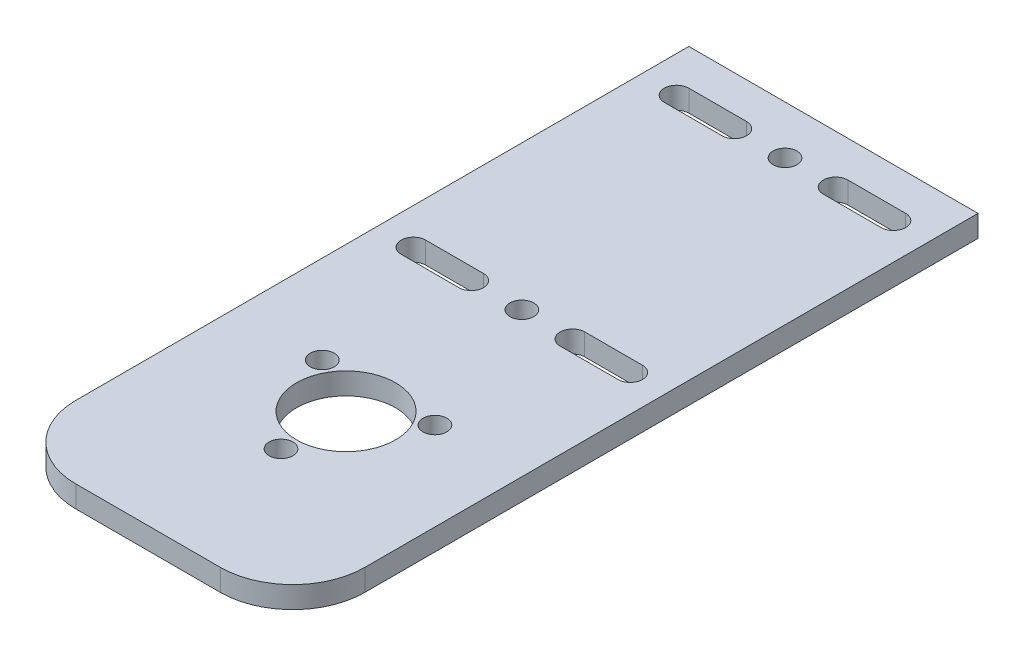
from build123d import *

# Parameters (mm, degrees)
SKETCH_1_R          = 1.65
SKETCH_1_R_2        = 6.85
EXTRUDE_1_DEPTH     = 3
FILLET_1_R          = 10
SKETCH_2_W          = 40
SKETCH_2_H          = 72.562953015
CUT_EXTRUDE_1_DEPTH = 10


with BuildPart() as part:
    # 草图1 → 凸台-拉伸1 (new body)
    with BuildSketch(Plane(origin=(0, 0, 0), x_dir=(1, 0, 0), z_dir=(0, 1, 0))):
        Polygon((0, 0), (0, 50.01), (40, 50.01), (40, 0), (40, -89.81), (0, -89.81), align=None)
        with Locations(Location((20, -1.7, 0), (0, 0, 270))):
            Circle(SKETCH_1_R, mode=Mode.SUBTRACT)
        with Locations(Location((20, -38.1, 0), (0, 0, 270))):
            Circle(SKETCH_1_R, mode=Mode.SUBTRACT)
        with Locations(Location((20, 31.62, 0), (0, 0, 270))):
            Circle(SKETCH_1_R, mode=Mode.SUBTRACT)
        with Locations(Location((27.794228634, 18.12, 0), (0, 0, 270))):
            Circle(SKETCH_1_R, mode=Mode.SUBTRACT)
        with Locations(Location((12.205771366, 18.12, 0), (0, 0, 270))):
            Circle(SKETCH_1_R, mode=Mode.SUBTRACT)
        with Locations(Location((27.794228634, -57.92, 0), (0, 0, 270))):
            Circle(SKETCH_1_R, mode=Mode.SUBTRACT)
        with Locations(Location((12.205771366, -57.92, 0), (0, 0, 270))):
            Circle(SKETCH_1_R, mode=Mode.SUBTRACT)
        with Locations(Location((20, -71.42, 0), (0, 0, 270))):
            Circle(SKETCH_1_R, mode=Mode.SUBTRACT)
        with Locations(Location((20, 22.62, 0), (0, 0, 270))):
            Circle(SKETCH_1_R_2, mode=Mode.SUBTRACT)
        with Locations(Location((20, -62.42, 0), (0, 0, 270))):
            Circle(SKETCH_1_R_2, mode=Mode.SUBTRACT)
        with BuildLine():
            Line((5, 0), (13, 0))
            ThreePointArc((13, 0), (14.7, -1.7), (13, -3.4))
            Line((13, -3.4), (5, -3.4))
            ThreePointArc((5, -3.4), (3.3, -1.7), (5, 0))
        make_face(mode=Mode.SUBTRACT)
        with BuildLine():
            Line((27, 0), (35, 0))
            ThreePointArc((35, 0), (36.7, -1.7), (35, -3.4))
            Line((35, -3.4), (27, -3.4))
            ThreePointArc((27, -3.4), (25.3, -1.7), (27, 0))
        make_face(mode=Mode.SUBTRACT)
        with BuildLine():
            Line((27, -39.8), (35, -39.8))
            ThreePointArc((35, -39.8), (36.7, -38.1), (35, -36.4))
            Line((35, -36.4), (27, -36.4))
            ThreePointArc((27, -36.4), (25.3, -38.1), (27, -39.8))
        make_face(mode=Mode.SUBTRACT)
        with BuildLine():
            Line((5, -39.8), (13, -39.8))
            ThreePointArc((13, -39.8), (14.7, -38.1), (13, -36.4))
            Line((13, -36.4), (5, -36.4))
            ThreePointArc((5, -36.4), (3.3, -38.1), (5, -39.8))
        make_face(mode=Mode.SUBTRACT)
    extrude(amount=EXTRUDE_1_DEPTH)

    # 圆角1
    fillet_1_edges = [part.edges().sort_by_distance(p)[0] for p in [
        (0, 1.5, -50.01),
        (40, 1.5, -50.01),
        (40, 1.5, 89.81),
        (0, 1.5, 89.81),
    ]]
    fillet(fillet_1_edges, radius=FILLET_1_R)

    # 草图2 → 切除-拉伸1 (cut)
    with BuildSketch(Plane(origin=(0, 3, 0), x_dir=(1, 0, 0), z_dir=(0, 1, 0))):
        with Locations((20, 41.281476508)):
            Rectangle(SKETCH_2_W, SKETCH_2_H)
    extrude(amount=-CUT_EXTRUDE_1_DEPTH, mode=Mode.SUBTRACT)


solid = part.part
